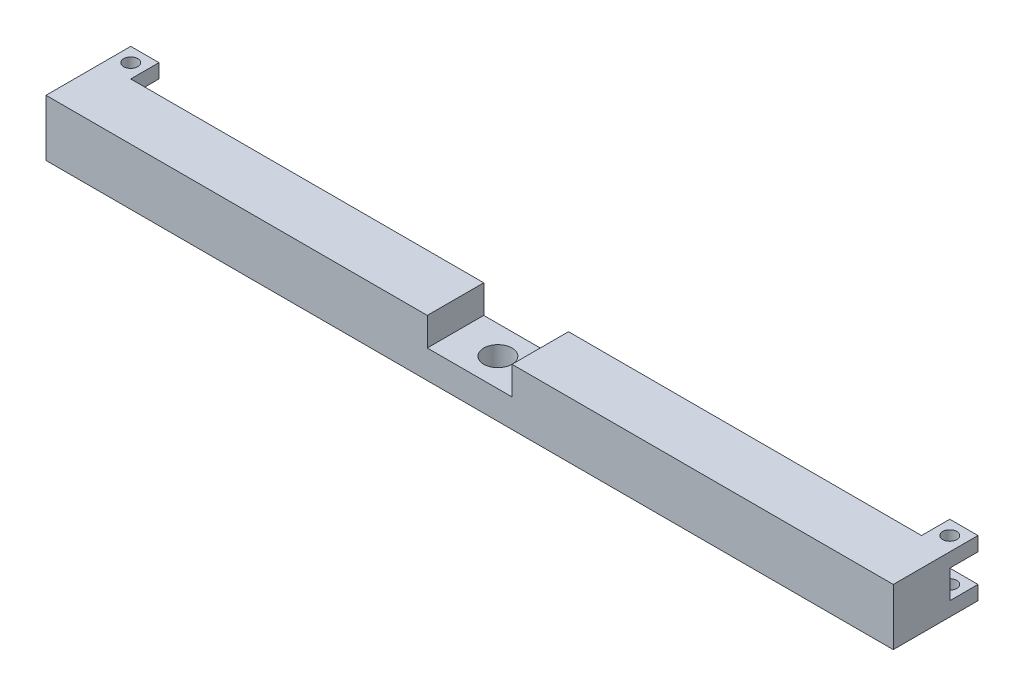
from build123d import *

# Parameters (mm, degrees)
SKETCH1_W           = 300
SKETCH1_H           = 20
SKETCH1_W_2         = 10
SKETCH1_H_2         = 10
BOSS_EXTRUDE1_DEPTH = 20
SKETCH6_W           = 10
SKETCH6_H           = 10
CUT_EXTRUDE5_DEPTH  = 10
SKETCH2_W           = 30
SKETCH2_H           = 20
CUT_EXTRUDE1_DEPTH  = 10
SKETCH4_R           = 2.5
CUT_EXTRUDE3_DEPTH  = 153.643375225
CUT_EXTRUDE4_REACH  = 153.658
SKETCH5_R           = 5


with BuildPart() as part:
    # Sketch1 → Boss-Extrude1 (new body)
    with BuildSketch(Plane(origin=(0, 0, 0), x_dir=(1, 0, 0), z_dir=(0, 1, 0))):
        Rectangle(SKETCH1_W, SKETCH1_H)
        with Locations((-145, 15)):
            Rectangle(SKETCH1_W_2, SKETCH1_H_2)
        with Locations((145, 15)):
            Rectangle(SKETCH1_W_2, SKETCH1_H_2)
    extrude(amount=BOSS_EXTRUDE1_DEPTH)

    # Sketch6 → Cut-Extrude5 (cut)
    with BuildSketch(Plane(origin=(0, 0, -20), x_dir=(-1, 0, 0), z_dir=(0, 0, -1))):
        with Locations((-145, 10)):
            Rectangle(SKETCH6_W, SKETCH6_H)
        with Locations((145, 10)):
            Rectangle(SKETCH6_W, SKETCH6_H)
    extrude(amount=-CUT_EXTRUDE5_DEPTH, mode=Mode.SUBTRACT)

    # Sketch2 → Cut-Extrude1 (cut)
    with BuildSketch(Plane(origin=(0, 20, 0), x_dir=(1, 0, 0), z_dir=(0, 1, 0))):
        Rectangle(SKETCH2_W, SKETCH2_H)
    extrude(amount=-CUT_EXTRUDE1_DEPTH, mode=Mode.SUBTRACT)

    # Sketch4 → Cut-Extrude3 (cut, through all)
    with BuildSketch(Plane(origin=(0, 20, 0), x_dir=(1, 0, 0), z_dir=(0, 1, 0))):
        with Locations(Location((-145, 15, 0), (0, 0, 90))):
            Circle(SKETCH4_R)
        with Locations(Location((145, 15, 0), (0, 0, 270))):
            Circle(SKETCH4_R)
    extrude(amount=-CUT_EXTRUDE3_DEPTH, mode=Mode.SUBTRACT)

    # Sketch5 → Cut-Extrude4 (cut, up to next)
    with BuildSketch(Plane(origin=(0, 10, 0), x_dir=(1, 0, 0), z_dir=(0, 1, 0)), mode=Mode.PRIVATE) as cut_extrude4_sk1:
        with Locations(Location((0, 0, 0), (0, 0, 270))):
            Circle(SKETCH5_R)
    cut_extrude4_tool1 = extrude(cut_extrude4_sk1.sketch, amount=-CUT_EXTRUDE4_REACH, mode=Mode.PRIVATE) & part.part
    add(cut_extrude4_tool1.solids().sort_by_distance((0, 10, 0))[0], mode=Mode.SUBTRACT)


solid = part.part
